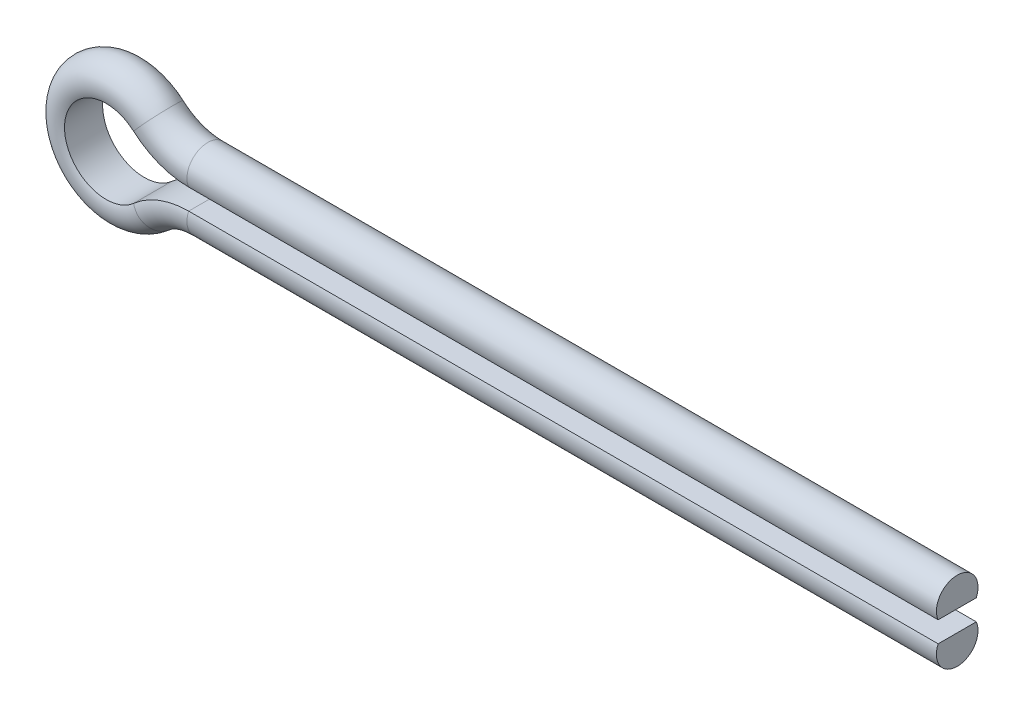
from build123d import *


with BuildPart() as part:
    # Sweep3: sweep along a path in Sketch22
    with BuildLine(Plane.XY) as sweep3_path:
        Line((96.096654275, 0), (6.018221692, 0))
        ThreePointArc((6.018221692, 0), (2.482687786, -0.645856533), (-0.596156586, -2.5))
        ThreePointArc((-0.596156586, -2.5), (-8.903345725, 1.25), (-0.596156586, 5))
        ThreePointArc((-0.596156586, 5), (2.482687786, 3.145856533), (6.018221692, 2.5))
        Line((6.018221692, 2.5), (96.096654275, 2.5))
    # Sketch25 → Sweep3 (sweep)
    with BuildSketch(Plane(origin=(96.096654275, 0, 0), x_dir=(0, 0, -1), z_dir=(1, 0, 0))):
        with BuildLine():
            Line((-2.291287847, 2.5), (2.291287847, 2.5))
            ThreePointArc((2.291287847, 2.5), (0, 6), (-2.291287847, 2.5))
        make_face()
    sweep(path=sweep3_path.line)


solid = part.part
